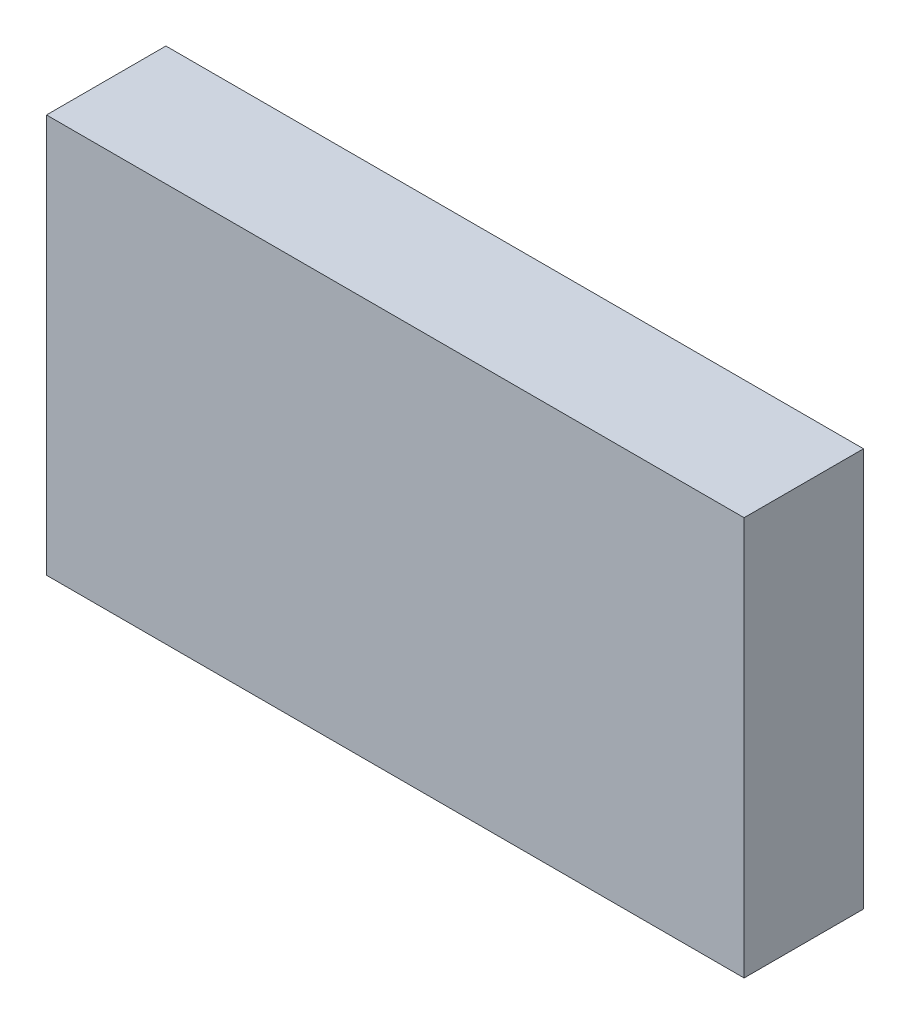
from build123d import *

# Parameters (mm, degrees)
SKETCH_1_W      = 58.42181208
SKETCH_1_H      = 33.383892618
EXTRUDE_1_DEPTH = 10


with BuildPart() as part:
    # Эскиз1 → Бобышка-Вытянуть1 (new body)
    with BuildSketch(Plane.XY):
        Rectangle(SKETCH_1_W, SKETCH_1_H)
    extrude(amount=EXTRUDE_1_DEPTH)


solid = part.part
